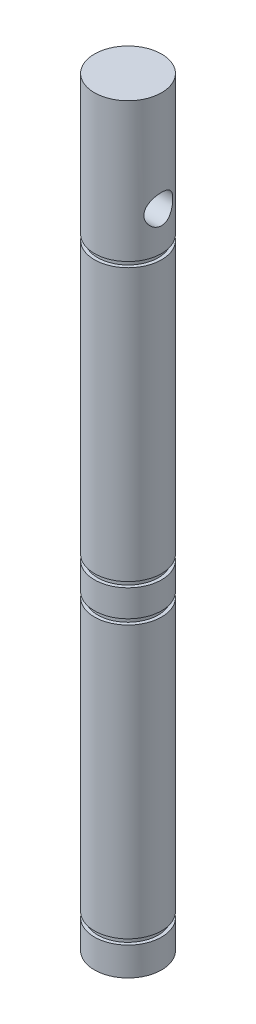
from build123d import *

# Parameters (mm, degrees)
SKETCH1_R            = 5
BOSS_EXTRUDE1_DEPTH  = 113.2
CUT_EXTRUDE2_START   = -4.25
SKETCH2_R            = 5
SKETCH2_R_2          = 4.5
CUT_EXTRUDE2_DEPTH   = 0.8
CUT_EXTRUDE3_START   = -45.55
SKETCH2_2_R          = 5
SKETCH2_2_R_2        = 4.5
CUT_EXTRUDE3_DEPTH   = 0.8
CUT_EXTRUDE4_START   = -50.35
SKETCH2_3_R          = 5
SKETCH2_3_R_2        = 4.5
CUT_EXTRUDE4_DEPTH   = 0.8
CUT_EXTRUDE5_START   = -91.65
SKETCH2_4_R          = 5
SKETCH2_4_R_2        = 4.5
CUT_EXTRUDE5_DEPTH   = 0.8
SKETCH4_R            = 1.5
CUT_EXTRUDE6_DEPTH   = 114.750780217
M4_CLEARANCE_HOLE1_D = 4.3


with BuildPart() as part:
    # Sketch1 → Boss-Extrude1 (new body)
    with BuildSketch(Plane(origin=(0, 0, 0), x_dir=(1, 0, 0), z_dir=(0, 1, 0))):
        Circle(SKETCH1_R)
    extrude(amount=BOSS_EXTRUDE1_DEPTH)

    # Sketch2 → Cut-Extrude2 (cut)
    with BuildSketch(Plane.XZ.offset(CUT_EXTRUDE2_START)):
        Circle(SKETCH2_R)
        Circle(SKETCH2_R_2, mode=Mode.SUBTRACT)
    extrude(amount=-CUT_EXTRUDE2_DEPTH, mode=Mode.SUBTRACT)

    # Sketch2<2> → Cut-Extrude3 (cut)
    with BuildSketch(Plane.XZ.offset(CUT_EXTRUDE3_START)):
        Circle(SKETCH2_2_R)
        Circle(SKETCH2_2_R_2, mode=Mode.SUBTRACT)
    extrude(amount=-CUT_EXTRUDE3_DEPTH, mode=Mode.SUBTRACT)

    # Sketch2<3> → Cut-Extrude4 (cut)
    with BuildSketch(Plane.XZ.offset(CUT_EXTRUDE4_START)):
        Circle(SKETCH2_3_R)
        Circle(SKETCH2_3_R_2, mode=Mode.SUBTRACT)
    extrude(amount=-CUT_EXTRUDE4_DEPTH, mode=Mode.SUBTRACT)

    # Sketch2<4> → Cut-Extrude5 (cut)
    with BuildSketch(Plane.XZ.offset(CUT_EXTRUDE5_START)):
        Circle(SKETCH2_4_R)
        Circle(SKETCH2_4_R_2, mode=Mode.SUBTRACT)
    extrude(amount=-CUT_EXTRUDE5_DEPTH, mode=Mode.SUBTRACT)

    # Sketch4 → Cut-Extrude6 (cut, through all)
    with BuildSketch(Plane(origin=(-5, 0, 0), x_dir=(0, 0, -1), z_dir=(1, 0, 0))):
        with Locations((0, 98.2)):
            Circle(SKETCH4_R)
    extrude(amount=CUT_EXTRUDE6_DEPTH, mode=Mode.SUBTRACT)

    # M4 Clearance Hole1 (through all)
    with Locations(Plane.ZY.offset(5)):
        with Locations((0, 98.2)):
            Hole(M4_CLEARANCE_HOLE1_D / 2)


solid = part.part
